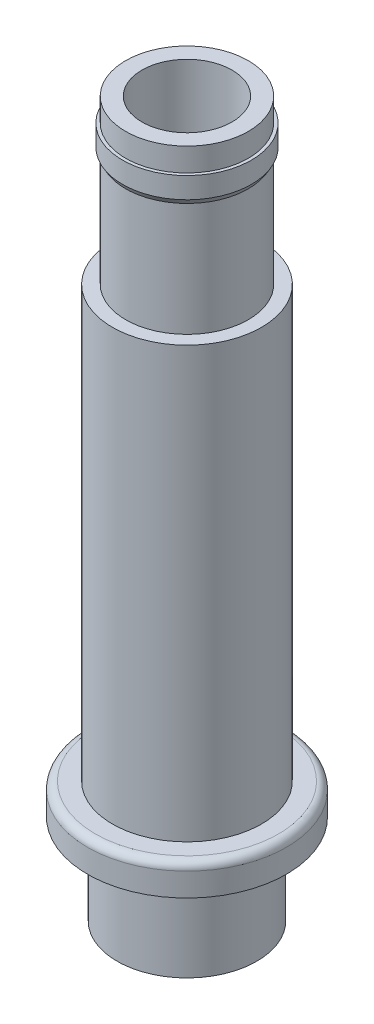
from build123d import *

# Parameters (mm, degrees)
FILLET1_R           = 0.5
BOSS_EXTRUDE1_REACH = 62.882
BOSS_EXTRUDE1_START = 14
SKETCH2_W           = 0.7
SKETCH2_H           = 1
CIRPATTERN1_COUNT   = 4


with BuildPart() as part:
    # Sketch1 → Revolve1 (revolve)
    with BuildSketch(Plane(origin=(0, 0, 0), x_dir=(0, 0, -1), z_dir=(1, 0, 0))):
        Polygon((3.15, 33), (3.15, 6.8), (3.5, 6.8), (3.5, 0), (4.5, 0), (4.5, 6.8), (5.4, 6.8), (5.4, 5.8), (6.4, 5.8), (6.4, 7.8), (4.8, 7.8), (4.8, 35.5), (3.95, 35.5), (3.95, 42.8), (4.15, 43.146410162), (4.15, 44.5), (3.95, 44.5), (3.95, 46), (2.9, 46), (2.9, 37.5), (1.75, 34), (1.75, 33), align=None)
    revolve(axis=Axis((0, 0, 0), (0, 1, 0)))

    # Fillet1
    fillet1_edges = [part.edges().sort_by_distance(p)[0] for p in [
        (0, 7.8, 6.4),
    ]]
    fillet(fillet1_edges, radius=FILLET1_R)

    # Sketch2 → Boss-Extrude1 (add, up to next)
    with BuildSketch(Plane(origin=(0, 0, 0), x_dir=(-1, 0, 0), z_dir=(0, 1, 0)).offset(BOSS_EXTRUDE1_START), mode=Mode.PRIVATE) as boss_extrude1_sk1:
        with Locations((0, 2.65)):
            Rectangle(SKETCH2_W, SKETCH2_H)
    boss_extrude1_tool1 = extrude(boss_extrude1_sk1.sketch, amount=BOSS_EXTRUDE1_REACH, mode=Mode.PRIVATE) - part.part
    boss_extrude1 = boss_extrude1_tool1.solids().sort_by_distance((0, 14, 2.65))[0]
    add(boss_extrude1)

    # CirPattern1: Boss-Extrude1 ×4 about axis
    cirpattern1_axis = Axis((0, 0, 0), (0, 1, 0))
    for i in range(1, CIRPATTERN1_COUNT):
        add(boss_extrude1.rotate(cirpattern1_axis, i * 360 / CIRPATTERN1_COUNT))


solid = part.part
